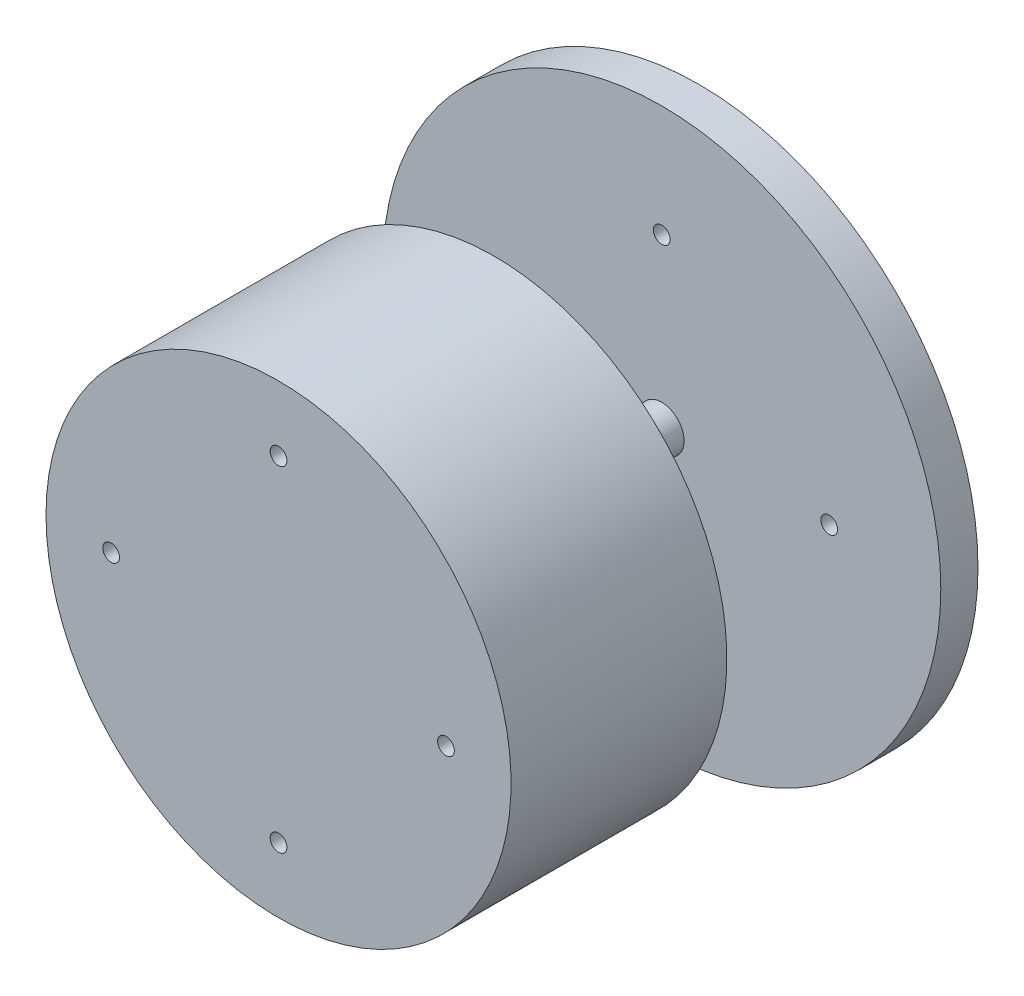
from build123d import *

# Parameters (mm, degrees)
SKETCH1_R           = 62.5
BOSS_EXTRUDE1_DEPTH = 58
SKETCH2_R           = 6
BOSS_EXTRUDE2_DEPTH = 113
SKETCH3_R           = 75
BOSS_EXTRUDE3_DEPTH = 10
SKETCH4_R           = 2.25
CUT_EXTRUDE1_DEPTH  = 133
SKETCH5_R           = 2.25
CUT_EXTRUDE2_DEPTH  = 133
SKETCH6_R           = 2.25
CUT_EXTRUDE3_DEPTH  = 133
SKETCH7_R           = 2.25
CUT_EXTRUDE4_DEPTH  = 133


with BuildPart() as part:
    # Sketch1 → Boss-Extrude1 (new body)
    with BuildSketch(Plane.XY.offset(55)):
        with Locations(Location((300, 300, 0), (0, 0, 180))):
            Circle(SKETCH1_R)
    extrude(amount=BOSS_EXTRUDE1_DEPTH)

    # Sketch2 → Boss-Extrude2 (add)
    with BuildSketch(Plane.XY):
        with Locations((300, 300)):
            Circle(SKETCH2_R)
    extrude(amount=BOSS_EXTRUDE2_DEPTH)

    # Sketch3 → Boss-Extrude3 (add)
    with BuildSketch(Plane.XY):
        with Locations((300, 300)):
            Circle(SKETCH3_R)
    extrude(amount=BOSS_EXTRUDE3_DEPTH)

    # Sketch4 → Cut-Extrude1 (cut)
    with BuildSketch(Plane.XY.offset(113)):
        with Locations((345, 300)):
            Circle(SKETCH4_R)
    extrude(amount=-CUT_EXTRUDE1_DEPTH, mode=Mode.SUBTRACT)

    # Sketch5 → Cut-Extrude2 (cut)
    with BuildSketch(Plane.XY.offset(113)):
        with Locations((255, 300)):
            Circle(SKETCH5_R)
    extrude(amount=-CUT_EXTRUDE2_DEPTH, mode=Mode.SUBTRACT)

    # Sketch6 → Cut-Extrude3 (cut)
    with BuildSketch(Plane.XY.offset(113)):
        with Locations((300, 345)):
            Circle(SKETCH6_R)
    extrude(amount=-CUT_EXTRUDE3_DEPTH, mode=Mode.SUBTRACT)

    # Sketch7 → Cut-Extrude4 (cut)
    with BuildSketch(Plane.XY.offset(113)):
        with Locations((300, 255)):
            Circle(SKETCH7_R)
    extrude(amount=-CUT_EXTRUDE4_DEPTH, mode=Mode.SUBTRACT)


solid = part.part
